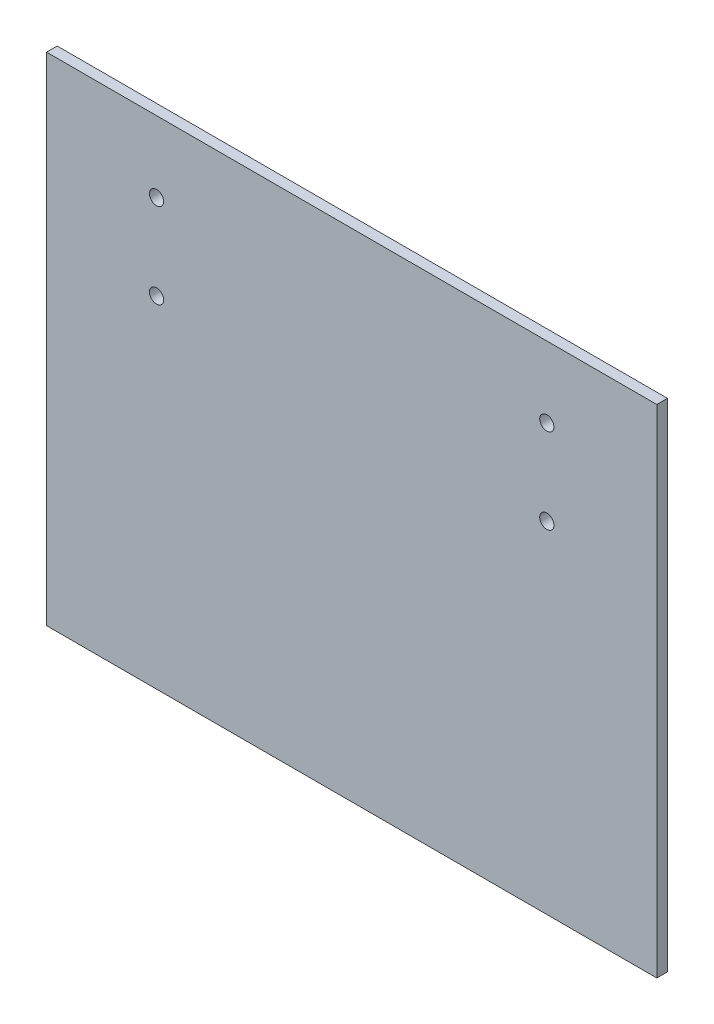
from build123d import *

# Parameters (mm, degrees)
SKETCH_1_W          = 172
SKETCH_1_H          = 140
EXTRUDE_1_DEPTH     = 3
SKETCH_2_R          = 2
CUT_EXTRUDE_1_DEPTH = 37


with BuildPart() as part:
    # 草图1 → 凸台-拉伸1 (new body)
    with BuildSketch(Plane.XY):
        with Locations((86, -70)):
            Rectangle(SKETCH_1_W, SKETCH_1_H)
    extrude(amount=EXTRUDE_1_DEPTH)

    # 草图2 → 切除-拉伸1 (cut)
    with BuildSketch(Plane.XY.offset(3)):
        with Locations((31, -20)):
            Circle(SKETCH_2_R)
        with Locations((31, -44)):
            Circle(SKETCH_2_R)
        with Locations((141, -44)):
            Circle(SKETCH_2_R)
        with Locations((141, -20)):
            Circle(SKETCH_2_R)
    extrude(amount=-CUT_EXTRUDE_1_DEPTH, mode=Mode.SUBTRACT)


solid = part.part
